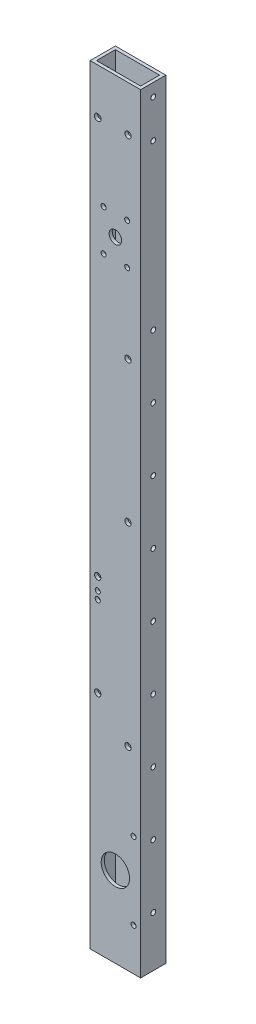
from build123d import *

# Parameters (mm, degrees)
SKETCH1_W               = 50.8
SKETCH1_H               = 25.4
SKETCH1_W_2             = 44.45
SKETCH1_H_2             = 19.05
BOSS_EXTRUDE1_DEPTH     = 774.7
SKETCH3_R               = 14.2875
CUT_EXTRUDE2_DEPTH      = 777.578000348
SKETCH2_R               = 6.35
CUT_EXTRUDE1_DEPTH      = 777.578000348
SKETCH4_R               = 2.54
CUT_EXTRUDE3_DEPTH      = 777.578000348
SKETCH5_R               = 2.54
CUT_EXTRUDE4_DEPTH      = 777.578000348
CUT_EXTRUDE5_DEPTH      = 777.578000348
CUT_EXTRUDE5_DEPTH_BACK = 777.578000348
SKETCH6_R               = 3.175
SKETCH8_R               = 2.5796875
CUT_EXTRUDE8_DEPTH      = 777.578000348
SKETCH10_R              = 3.175
SKETCH10_R_2            = 3.3734375
CUT_EXTRUDE9_DEPTH      = 777.578000348
CUT_EXTRUDE10_REACH     = 778.682
SKETCH11_R              = 2.4638
CUT_EXTRUDE11_REACH     = 778.682
SKETCH12_R              = 2.4638
CUT_EXTRUDE12_REACH     = 778.682
SKETCH13_R              = 2.4638


with BuildPart() as part:
    # Sketch1 → Boss-Extrude1 (new body)
    with BuildSketch(Plane(origin=(0, 0, 0), x_dir=(1, 0, 0), z_dir=(0, 1, 0))):
        with Locations((22.225, 9.525)):
            Rectangle(SKETCH1_W, SKETCH1_H)
        with Locations((22.225, 9.525)):
            Rectangle(SKETCH1_W_2, SKETCH1_H_2, mode=Mode.SUBTRACT)
    extrude(amount=BOSS_EXTRUDE1_DEPTH)

    # Sketch3 → Cut-Extrude2 (cut, through all)
    with BuildSketch(Plane.XY.offset(3.175)):
        with Locations((22.225, 81.28)):
            Circle(SKETCH3_R)
    extrude(amount=-CUT_EXTRUDE2_DEPTH, mode=Mode.SUBTRACT)

    # Sketch2 → Cut-Extrude1 (cut, through all)
    with BuildSketch(Plane.XY.offset(3.175)):
        with Locations((22.225, 633.476)):
            Circle(SKETCH2_R)
    extrude(amount=-CUT_EXTRUDE1_DEPTH, mode=Mode.SUBTRACT)

    # Sketch4 → Cut-Extrude3 (cut, through all)
    with BuildSketch(Plane.XY.offset(3.175)):
        with Locations((40.511702836, 42.589037005)):
            Circle(SKETCH4_R)
        with Locations((40.511702836, 119.970962995)):
            Circle(SKETCH4_R)
    extrude(amount=-CUT_EXTRUDE3_DEPTH, mode=Mode.SUBTRACT)

    # Sketch5 → Cut-Extrude4 (cut, through all)
    with BuildSketch(Plane(origin=(0, 0, -22.225), x_dir=(-1, 0, 0), z_dir=(0, 0, -1))):
        with Locations((-10.31875, 612.853770072)):
            Circle(SKETCH5_R)
        with Locations((-34.13125, 612.853770072)):
            Circle(SKETCH5_R)
        with Locations((-10.31875, 654.098229928)):
            Circle(SKETCH5_R)
        with Locations((-34.13125, 654.098229928)):
            Circle(SKETCH5_R)
    extrude(amount=-CUT_EXTRUDE4_DEPTH, mode=Mode.SUBTRACT)

    # Sketch6 → Cut-Extrude5 (cut, two sides: drawn at the far end of the back side and taken through both)
    with BuildSketch(Plane.XY.offset(3.175).offset(-CUT_EXTRUDE5_DEPTH_BACK)):
        with Locations((4.445, 227.076)):
            Circle(SKETCH6_R)
        with Locations((4.445, 328.676)):
            Circle(SKETCH6_R)
    extrude(amount=CUT_EXTRUDE5_DEPTH + CUT_EXTRUDE5_DEPTH_BACK, mode=Mode.SUBTRACT)

    # Sketch8 → Cut-Extrude8 (cut, through all)
    with BuildSketch(Plane.XY.offset(3.175)):
        with Locations((4.445, 315.976)):
            Circle(SKETCH8_R)
        with Locations((4.445, 308.356)):
            Circle(SKETCH8_R)
    extrude(amount=-CUT_EXTRUDE8_DEPTH, mode=Mode.SUBTRACT)

    # Sketch10 → Cut-Extrude9 (cut, through all)
    with BuildSketch(Plane.XY.offset(3.175)):
        with Locations((34.925, 195.58)):
            Circle(SKETCH10_R)
        with Locations((34.925, 391.16)):
            Circle(SKETCH10_R)
        with Locations((34.925, 533.4)):
            Circle(SKETCH10_R)
        with Locations((34.925, 728.98)):
            Circle(SKETCH10_R)
        with Locations((4.445, 728.98)):
            Circle(SKETCH10_R_2)
    extrude(amount=-CUT_EXTRUDE9_DEPTH, mode=Mode.SUBTRACT)

    # Sketch11 → Cut-Extrude10 (cut, up to next)
    with BuildSketch(Plane.ZY.offset(3.175), mode=Mode.PRIVATE) as cut_extrude10_sk1:
        with Locations((-9.525, 762)):
            Circle(SKETCH11_R)
    cut_extrude10_tool1 = extrude(cut_extrude10_sk1.sketch, amount=-CUT_EXTRUDE10_REACH, mode=Mode.PRIVATE) & part.part
    # Sketch11 → Cut-Extrude10 (cut, up to next)
    with BuildSketch(Plane.ZY.offset(3.175), mode=Mode.PRIVATE) as cut_extrude10_sk2:
        with Locations((-9.525, 723.9)):
            Circle(SKETCH11_R)
    cut_extrude10_tool2 = extrude(cut_extrude10_sk2.sketch, amount=-CUT_EXTRUDE10_REACH, mode=Mode.PRIVATE) & part.part
    # Sketch11 → Cut-Extrude10 (cut, up to next)
    with BuildSketch(Plane.ZY.offset(3.175), mode=Mode.PRIVATE) as cut_extrude10_sk3:
        with Locations((-9.525, 558.8)):
            Circle(SKETCH11_R)
    cut_extrude10_tool3 = extrude(cut_extrude10_sk3.sketch, amount=-CUT_EXTRUDE10_REACH, mode=Mode.PRIVATE) & part.part
    # Sketch11 → Cut-Extrude10 (cut, up to next)
    with BuildSketch(Plane.ZY.offset(3.175), mode=Mode.PRIVATE) as cut_extrude10_sk4:
        with Locations((-9.525, 533.4)):
            Circle(SKETCH11_R)
    cut_extrude10_tool4 = extrude(cut_extrude10_sk4.sketch, amount=-CUT_EXTRUDE10_REACH, mode=Mode.PRIVATE) & part.part
    # Sketch11 → Cut-Extrude10 (cut, up to next)
    with BuildSketch(Plane.ZY.offset(3.175), mode=Mode.PRIVATE) as cut_extrude10_sk5:
        with Locations((-9.525, 495.3)):
            Circle(SKETCH11_R)
    cut_extrude10_tool5 = extrude(cut_extrude10_sk5.sketch, amount=-CUT_EXTRUDE10_REACH, mode=Mode.PRIVATE) & part.part
    # Sketch11 → Cut-Extrude10 (cut, up to next)
    with BuildSketch(Plane.ZY.offset(3.175), mode=Mode.PRIVATE) as cut_extrude10_sk6:
        with Locations((-9.525, 50.8)):
            Circle(SKETCH11_R)
    cut_extrude10_tool6 = extrude(cut_extrude10_sk6.sketch, amount=-CUT_EXTRUDE10_REACH, mode=Mode.PRIVATE) & part.part
    # Sketch11 → Cut-Extrude10 (cut, up to next)
    with BuildSketch(Plane.ZY.offset(3.175), mode=Mode.PRIVATE) as cut_extrude10_sk7:
        with Locations((-9.525, 12.7)):
            Circle(SKETCH11_R)
    cut_extrude10_tool7 = extrude(cut_extrude10_sk7.sketch, amount=-CUT_EXTRUDE10_REACH, mode=Mode.PRIVATE) & part.part
    add(cut_extrude10_tool1.solids().sort_by_distance((-3.175, 762, -9.525))[0], mode=Mode.SUBTRACT)
    add(cut_extrude10_tool2.solids().sort_by_distance((-3.175, 723.9, -9.525))[0], mode=Mode.SUBTRACT)
    add(cut_extrude10_tool3.solids().sort_by_distance((-3.175, 558.8, -9.525))[0], mode=Mode.SUBTRACT)
    add(cut_extrude10_tool4.solids().sort_by_distance((-3.175, 533.4, -9.525))[0], mode=Mode.SUBTRACT)
    add(cut_extrude10_tool5.solids().sort_by_distance((-3.175, 495.3, -9.525))[0], mode=Mode.SUBTRACT)
    add(cut_extrude10_tool6.solids().sort_by_distance((-3.175, 50.8, -9.525))[0], mode=Mode.SUBTRACT)
    add(cut_extrude10_tool7.solids().sort_by_distance((-3.175, 12.7, -9.525))[0], mode=Mode.SUBTRACT)

    # Sketch12 → Cut-Extrude11 (cut, up to next)
    with BuildSketch(Plane(origin=(47.625, 0, 0), x_dir=(0, 0, -1), z_dir=(1, 0, 0)), mode=Mode.PRIVATE) as cut_extrude11_sk1:
        with Locations(Location((9.525, 50.8, 0), (0, 0, 180))):
            Circle(SKETCH12_R)
    cut_extrude11_tool1 = extrude(cut_extrude11_sk1.sketch, amount=-CUT_EXTRUDE11_REACH, mode=Mode.PRIVATE) & part.part
    # Sketch12 → Cut-Extrude11 (cut, up to next)
    with BuildSketch(Plane(origin=(47.625, 0, 0), x_dir=(0, 0, -1), z_dir=(1, 0, 0)), mode=Mode.PRIVATE) as cut_extrude11_sk2:
        with Locations((9.525, 114.3)):
            Circle(SKETCH12_R)
    cut_extrude11_tool2 = extrude(cut_extrude11_sk2.sketch, amount=-CUT_EXTRUDE11_REACH, mode=Mode.PRIVATE) & part.part
    # Sketch12 → Cut-Extrude11 (cut, up to next)
    with BuildSketch(Plane(origin=(47.625, 0, 0), x_dir=(0, 0, -1), z_dir=(1, 0, 0)), mode=Mode.PRIVATE) as cut_extrude11_sk3:
        with Locations((9.525, 177.8)):
            Circle(SKETCH12_R)
    cut_extrude11_tool3 = extrude(cut_extrude11_sk3.sketch, amount=-CUT_EXTRUDE11_REACH, mode=Mode.PRIVATE) & part.part
    # Sketch12 → Cut-Extrude11 (cut, up to next)
    with BuildSketch(Plane(origin=(47.625, 0, 0), x_dir=(0, 0, -1), z_dir=(1, 0, 0)), mode=Mode.PRIVATE) as cut_extrude11_sk4:
        with Locations((9.525, 241.3)):
            Circle(SKETCH12_R)
    cut_extrude11_tool4 = extrude(cut_extrude11_sk4.sketch, amount=-CUT_EXTRUDE11_REACH, mode=Mode.PRIVATE) & part.part
    # Sketch12 → Cut-Extrude11 (cut, up to next)
    with BuildSketch(Plane(origin=(47.625, 0, 0), x_dir=(0, 0, -1), z_dir=(1, 0, 0)), mode=Mode.PRIVATE) as cut_extrude11_sk5:
        with Locations((9.525, 304.8)):
            Circle(SKETCH12_R)
    cut_extrude11_tool5 = extrude(cut_extrude11_sk5.sketch, amount=-CUT_EXTRUDE11_REACH, mode=Mode.PRIVATE) & part.part
    # Sketch12 → Cut-Extrude11 (cut, up to next)
    with BuildSketch(Plane(origin=(47.625, 0, 0), x_dir=(0, 0, -1), z_dir=(1, 0, 0)), mode=Mode.PRIVATE) as cut_extrude11_sk6:
        with Locations((9.525, 368.3)):
            Circle(SKETCH12_R)
    cut_extrude11_tool6 = extrude(cut_extrude11_sk6.sketch, amount=-CUT_EXTRUDE11_REACH, mode=Mode.PRIVATE) & part.part
    # Sketch12 → Cut-Extrude11 (cut, up to next)
    with BuildSketch(Plane(origin=(47.625, 0, 0), x_dir=(0, 0, -1), z_dir=(1, 0, 0)), mode=Mode.PRIVATE) as cut_extrude11_sk7:
        with Locations((9.525, 431.8)):
            Circle(SKETCH12_R)
    cut_extrude11_tool7 = extrude(cut_extrude11_sk7.sketch, amount=-CUT_EXTRUDE11_REACH, mode=Mode.PRIVATE) & part.part
    # Sketch12 → Cut-Extrude11 (cut, up to next)
    with BuildSketch(Plane(origin=(47.625, 0, 0), x_dir=(0, 0, -1), z_dir=(1, 0, 0)), mode=Mode.PRIVATE) as cut_extrude11_sk8:
        with Locations(Location((9.525, 495.3, 0), (0, 0, 180))):
            Circle(SKETCH12_R)
    cut_extrude11_tool8 = extrude(cut_extrude11_sk8.sketch, amount=-CUT_EXTRUDE11_REACH, mode=Mode.PRIVATE) & part.part
    # Sketch12 → Cut-Extrude11 (cut, up to next)
    with BuildSketch(Plane(origin=(47.625, 0, 0), x_dir=(0, 0, -1), z_dir=(1, 0, 0)), mode=Mode.PRIVATE) as cut_extrude11_sk9:
        with Locations(Location((9.525, 558.8, 0), (0, 0, 180))):
            Circle(SKETCH12_R)
    cut_extrude11_tool9 = extrude(cut_extrude11_sk9.sketch, amount=-CUT_EXTRUDE11_REACH, mode=Mode.PRIVATE) & part.part
    add(cut_extrude11_tool1.solids().sort_by_distance((47.625, 50.8, -9.525))[0], mode=Mode.SUBTRACT)
    add(cut_extrude11_tool2.solids().sort_by_distance((47.625, 114.3, -9.525))[0], mode=Mode.SUBTRACT)
    add(cut_extrude11_tool3.solids().sort_by_distance((47.625, 177.8, -9.525))[0], mode=Mode.SUBTRACT)
    add(cut_extrude11_tool4.solids().sort_by_distance((47.625, 241.3, -9.525))[0], mode=Mode.SUBTRACT)
    add(cut_extrude11_tool5.solids().sort_by_distance((47.625, 304.8, -9.525))[0], mode=Mode.SUBTRACT)
    add(cut_extrude11_tool6.solids().sort_by_distance((47.625, 368.3, -9.525))[0], mode=Mode.SUBTRACT)
    add(cut_extrude11_tool7.solids().sort_by_distance((47.625, 431.8, -9.525))[0], mode=Mode.SUBTRACT)
    add(cut_extrude11_tool8.solids().sort_by_distance((47.625, 495.3, -9.525))[0], mode=Mode.SUBTRACT)
    add(cut_extrude11_tool9.solids().sort_by_distance((47.625, 558.8, -9.525))[0], mode=Mode.SUBTRACT)

    # Sketch13 → Cut-Extrude12 (cut, up to next)
    with BuildSketch(Plane(origin=(47.625, 0, 0), x_dir=(0, 0, -1), z_dir=(1, 0, 0)), mode=Mode.PRIVATE) as cut_extrude12_sk1:
        with Locations(Location((9.525, 762, 0), (0, 0, 180))):
            Circle(SKETCH13_R)
    cut_extrude12_tool1 = extrude(cut_extrude12_sk1.sketch, amount=-CUT_EXTRUDE12_REACH, mode=Mode.PRIVATE) & part.part
    # Sketch13 → Cut-Extrude12 (cut, up to next)
    with BuildSketch(Plane(origin=(47.625, 0, 0), x_dir=(0, 0, -1), z_dir=(1, 0, 0)), mode=Mode.PRIVATE) as cut_extrude12_sk2:
        with Locations(Location((9.525, 723.9, 0), (0, 0, 180))):
            Circle(SKETCH13_R)
    cut_extrude12_tool2 = extrude(cut_extrude12_sk2.sketch, amount=-CUT_EXTRUDE12_REACH, mode=Mode.PRIVATE) & part.part
    add(cut_extrude12_tool1.solids().sort_by_distance((47.625, 762, -9.525))[0], mode=Mode.SUBTRACT)
    add(cut_extrude12_tool2.solids().sort_by_distance((47.625, 723.9, -9.525))[0], mode=Mode.SUBTRACT)


solid = part.part
